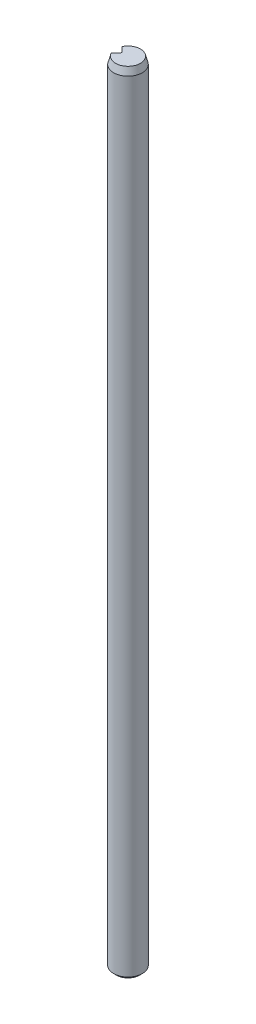
from build123d import *

# Parameters (mm, degrees)
SKETCH1_R           = 1
BOSS_EXTRUDE1_DEPTH = 55
CUT_EXTRUDE1_DEPTH  = 56.018178814
FILLET1_R           = 0.1
CHAMFER1_SIZE       = 0.5
CHAMFER1_SIZE2      = 0.133974596
CHAMFER2_SIZE       = 0.2


with BuildPart() as part:
    # Sketch1 → Boss-Extrude1 (new body)
    with BuildSketch(Plane(origin=(0, 0, 0), x_dir=(1, 0, 0), z_dir=(0, 1, 0))):
        with Locations(Location((0, 0, 0), (0, 0, 270))):
            Circle(SKETCH1_R)
    extrude(amount=BOSS_EXTRUDE1_DEPTH)

    # Sketch2 → Cut-Extrude1 (cut, through all)
    with BuildSketch(Plane(origin=(0, 55, 0), x_dir=(1, 0, 0), z_dir=(0, 1, 0))):
        with BuildLine():
            Line((-0.878280893, 0.478145033), (-0.40013586, 0))
            Line((-0.40013586, 0), (-0.878280893, -0.478145033))
            ThreePointArc((-0.878280893, -0.478145033), (-1, 0), (-0.878280893, 0.478145033))
        make_face()
    extrude(amount=-CUT_EXTRUDE1_DEPTH, mode=Mode.SUBTRACT)

    # Fillet1
    fillet1_edges = [part.edges().sort_by_distance(p)[0] for p in [
        (-0.40013586, 27.5, 0),
    ]]
    fillet(fillet1_edges, radius=FILLET1_R)

    # Chamfer1
    chamfer1_edges = [part.edges().sort_by_distance(p)[0] for p in [
        (1, 55, 0),
    ]]
    chamfer1_side = [part.faces().sort_by_distance(p)[0] for p in [
        (1, 27.5, 0),
    ]]
    chamfer(chamfer1_edges, length=CHAMFER1_SIZE, length2=CHAMFER1_SIZE2, reference=chamfer1_side[0])

    # Chamfer2
    chamfer2_edges = [part.edges().sort_by_distance(p)[0] for p in [
        (1, 0, 0),
    ]]
    chamfer(chamfer2_edges, length=CHAMFER2_SIZE)


solid = part.part
